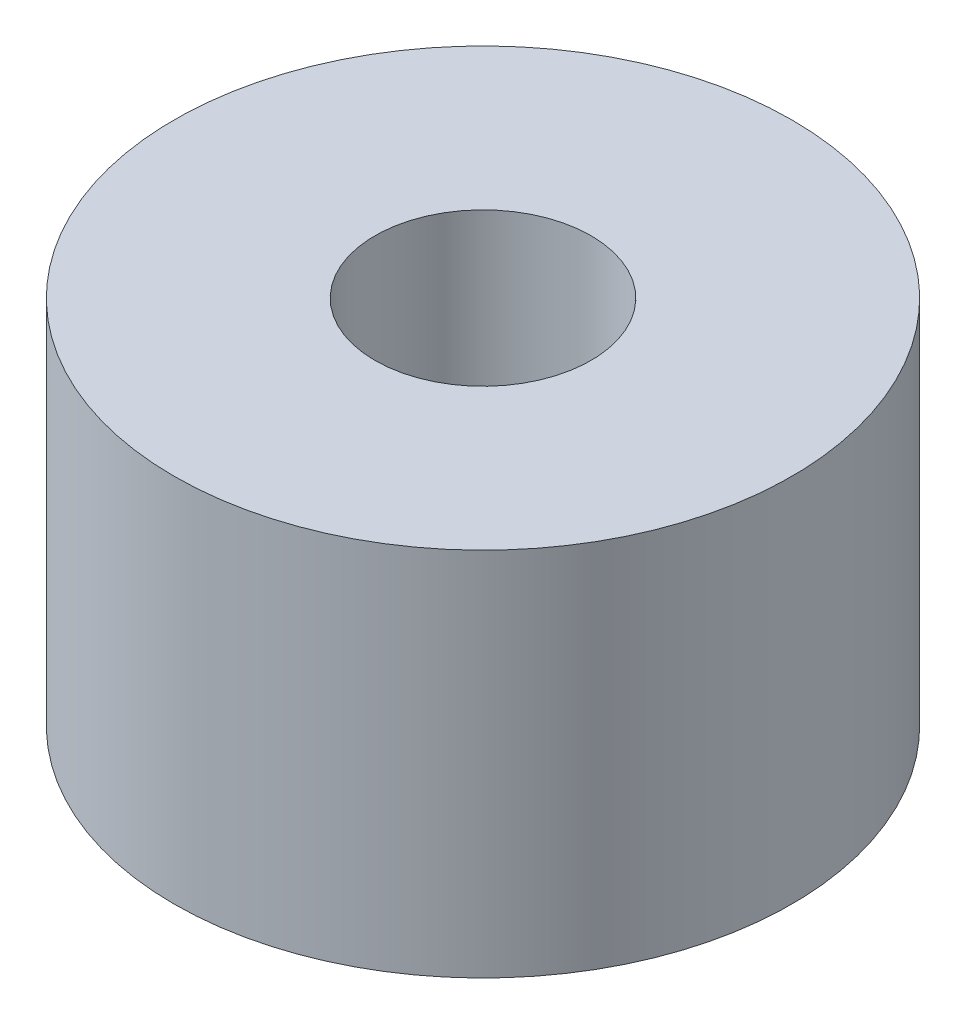
from build123d import *

# Parameters (mm, degrees)
CROQUIS1_R     = 10
CROQUIS1_R_2   = 3.5
EXTRUIR1_DEPTH = 12


with BuildPart() as part:
    # Croquis1 → Extruir1 (new body)
    with BuildSketch(Plane(origin=(0, 0, 0), x_dir=(1, 0, 0), z_dir=(0, 1, 0))):
        with Locations(Location((0, 0, 0), (0, 0, 270))):
            Circle(CROQUIS1_R)
        with Locations(Location((0, 0, 0), (0, 0, 270))):
            Circle(CROQUIS1_R_2, mode=Mode.SUBTRACT)
    extrude(amount=EXTRUIR1_DEPTH)


solid = part.part
